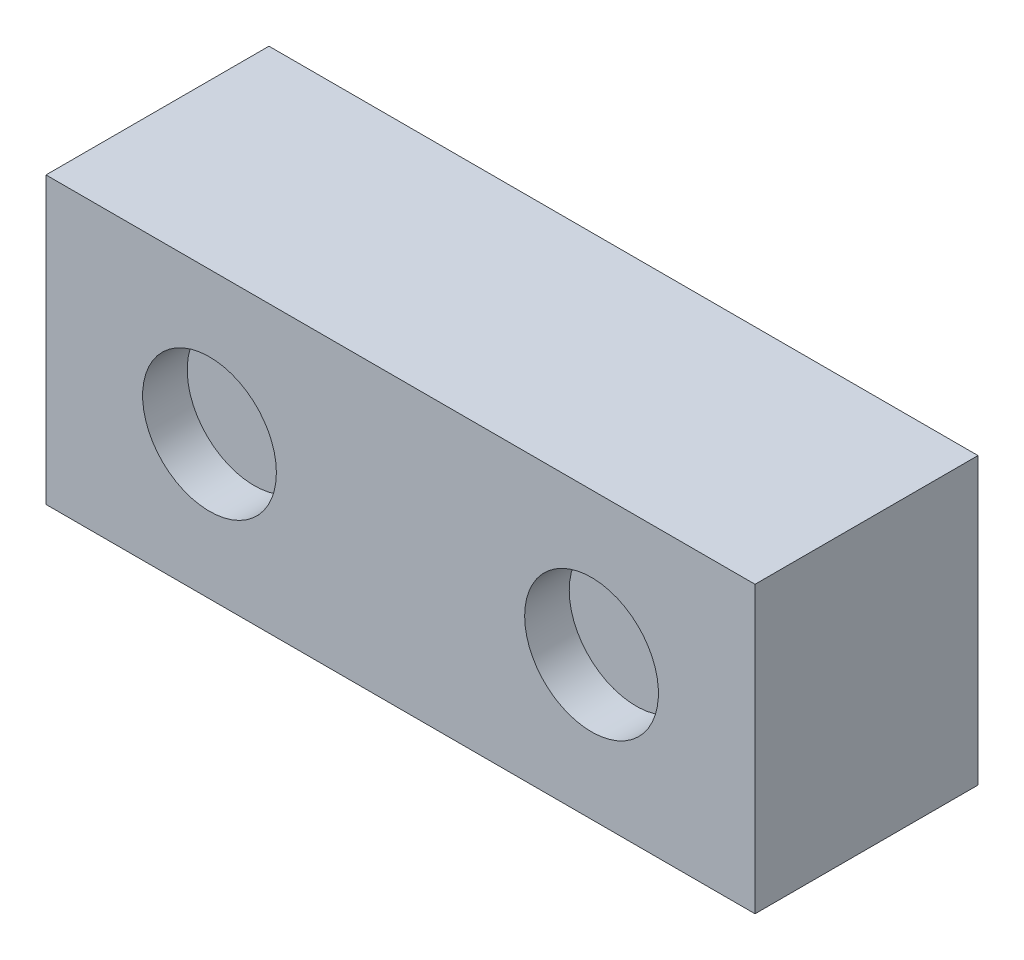
from build123d import *

# Parameters (mm, degrees)
CROQUIS1_W              = 31.8
CROQUIS1_H              = 12.8
SALIENTE_EXTRUIR1_DEPTH = 10
CROQUIS2_R              = 3
CORTAR_EXTRUIR1_DEPTH   = 2


with BuildPart() as part:
    # Croquis1 → Saliente-Extruir1 (new body)
    with BuildSketch(Plane.XY):
        Rectangle(CROQUIS1_W, CROQUIS1_H)
    extrude(amount=SALIENTE_EXTRUIR1_DEPTH)

    # Croquis2 → Cortar-Extruir1 (cut)
    with BuildSketch(Plane.XY.offset(10)):
        with Locations((-8.567084413, 0)):
            Circle(CROQUIS2_R)
    cortar_extruir1 = extrude(amount=-CORTAR_EXTRUIR1_DEPTH, mode=Mode.SUBTRACT)

    # Simetría1: Cortar-Extruir1 across plane
    add(cortar_extruir1.mirror(Plane(origin=(0, 0, 0), x_dir=(0, 0, 1), z_dir=(1, 0, 0))), mode=Mode.SUBTRACT)


solid = part.part
